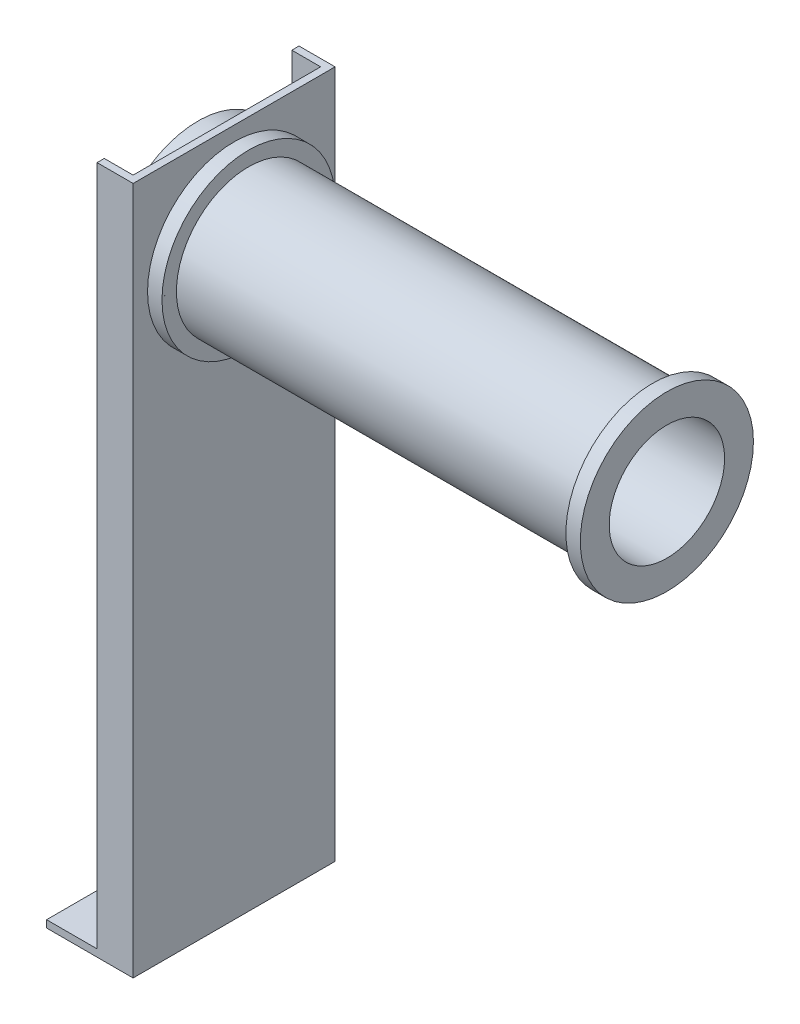
from build123d import *

# Parameters (mm, degrees)
SKETCH1_W           = 44.45
SKETCH1_H           = 149.86
BOSS_EXTRUDE1_DEPTH = 1.5875
SKETCH2_W           = 1.5875
SKETCH2_H           = 149.86
BOSS_EXTRUDE2_DEPTH = 6.35
SKETCH3_W           = 19.05
SKETCH3_H           = 44.45
BOSS_EXTRUDE3_DEPTH = 1.5875
SKETCH4_R           = 19.05
BOSS_EXTRUDE4_DEPTH = 3.175
SKETCH5_R           = 15.875
BOSS_EXTRUDE5_DEPTH = 88.9
SKETCH6_R           = 19.05
BOSS_EXTRUDE6_DEPTH = 3.175
BOSS_EXTRUDE7_START = 6.35
SKETCH7_R           = 19.05
BOSS_EXTRUDE7_DEPTH = 6.35
SKETCH8_R           = 12.7
CUT_EXTRUDE1_DEPTH  = 113.665


with BuildPart() as part:
    # Sketch1 → Boss-Extrude1 (new body)
    with BuildSketch(Plane(origin=(0, 0, 0), x_dir=(0, 0, -1), z_dir=(1, 0, 0))):
        Rectangle(SKETCH1_W, SKETCH1_H)
    extrude(amount=BOSS_EXTRUDE1_DEPTH)

    # Sketch2 → Boss-Extrude2 (add)
    with BuildSketch(Plane.ZY):
        with Locations((21.43125, 0)):
            Rectangle(SKETCH2_W, SKETCH2_H)
        with Locations((-21.43125, 0)):
            Rectangle(SKETCH2_W, SKETCH2_H)
    extrude(amount=BOSS_EXTRUDE2_DEPTH)

    # Sketch3 → Boss-Extrude3 (add)
    with BuildSketch(Plane.XZ.offset(74.93)):
        with Locations((-7.9375, 0)):
            Rectangle(SKETCH3_W, SKETCH3_H)
    extrude(amount=BOSS_EXTRUDE3_DEPTH)

    # Sketch4 → Boss-Extrude4 (add)
    with BuildSketch(Plane(origin=(1.5875, 0, 0), x_dir=(0, 0, -1), z_dir=(1, 0, 0))):
        with Locations(Location((0, 52.705, 0), (0, 0, 180))):
            Circle(SKETCH4_R)
    extrude(amount=BOSS_EXTRUDE4_DEPTH)

    # Sketch5 → Boss-Extrude5 (add)
    with BuildSketch(Plane(origin=(4.7625, 0, 0), x_dir=(0, 0, -1), z_dir=(1, 0, 0))):
        with Locations((0, 52.705)):
            Circle(SKETCH5_R)
    extrude(amount=BOSS_EXTRUDE5_DEPTH)

    # Sketch6 → Boss-Extrude6 (add)
    with BuildSketch(Plane(origin=(93.6625, 0, 0), x_dir=(0, 0, -1), z_dir=(1, 0, 0))):
        with Locations(Location((0, 52.705, 0), (0, 0, 180))):
            Circle(SKETCH6_R)
    extrude(amount=BOSS_EXTRUDE6_DEPTH)

    # Sketch7 → Boss-Extrude7 (add)
    with BuildSketch(Plane.ZY.offset(BOSS_EXTRUDE7_START)):
        with Locations((0, 52.705)):
            Circle(SKETCH7_R)
    extrude(amount=-BOSS_EXTRUDE7_DEPTH)

    # Sketch8 → Cut-Extrude1 (cut)
    with BuildSketch(Plane(origin=(96.8375, 0, 0), x_dir=(0, 0, -1), z_dir=(1, 0, 0))):
        with Locations((0, 52.705)):
            Circle(SKETCH8_R)
    extrude(amount=-CUT_EXTRUDE1_DEPTH, mode=Mode.SUBTRACT)


solid = part.part
